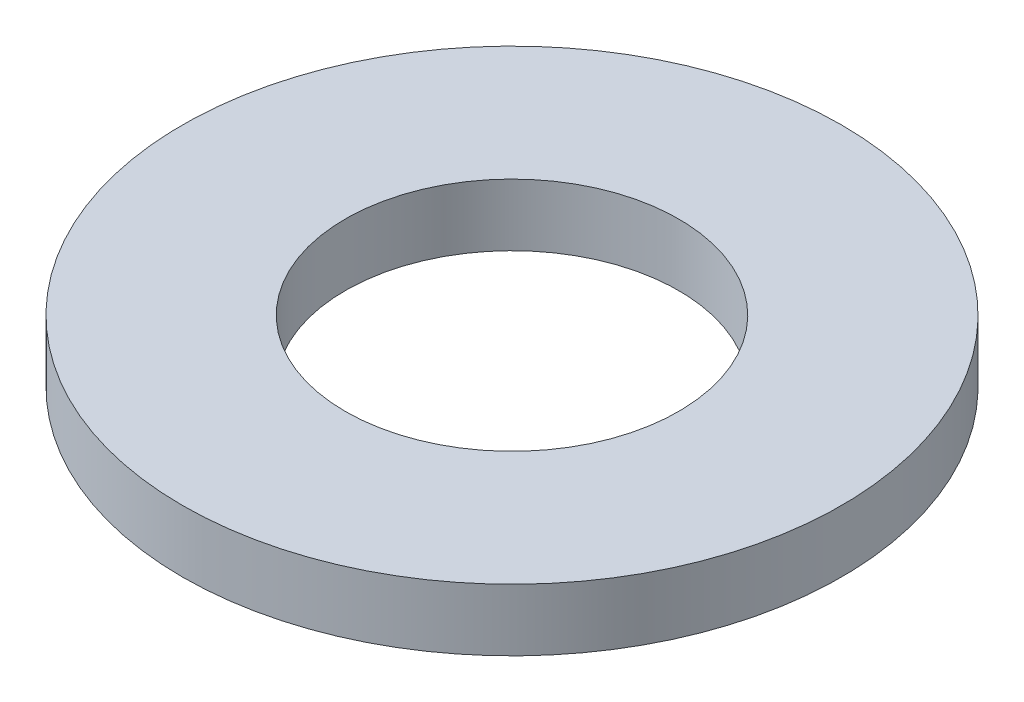
from build123d import *

# Parameters (mm, degrees)
SKETCH_1_R      = 4.25
SKETCH_1_R_2    = 2.15
EXTRUDE_1_DEPTH = 0.8


with BuildPart() as part:
    # 草图1 → 凸台-拉伸1 (new body)
    with BuildSketch(Plane(origin=(0, 0, 0), x_dir=(1, 0, 0), z_dir=(0, 1, 0))):
        with Locations(Location((0, 0, 0), (0, 0, 270))):
            Circle(SKETCH_1_R)
        with Locations(Location((0, 0, 0), (0, 0, 270))):
            Circle(SKETCH_1_R_2, mode=Mode.SUBTRACT)
    extrude(amount=EXTRUDE_1_DEPTH)


solid = part.part
